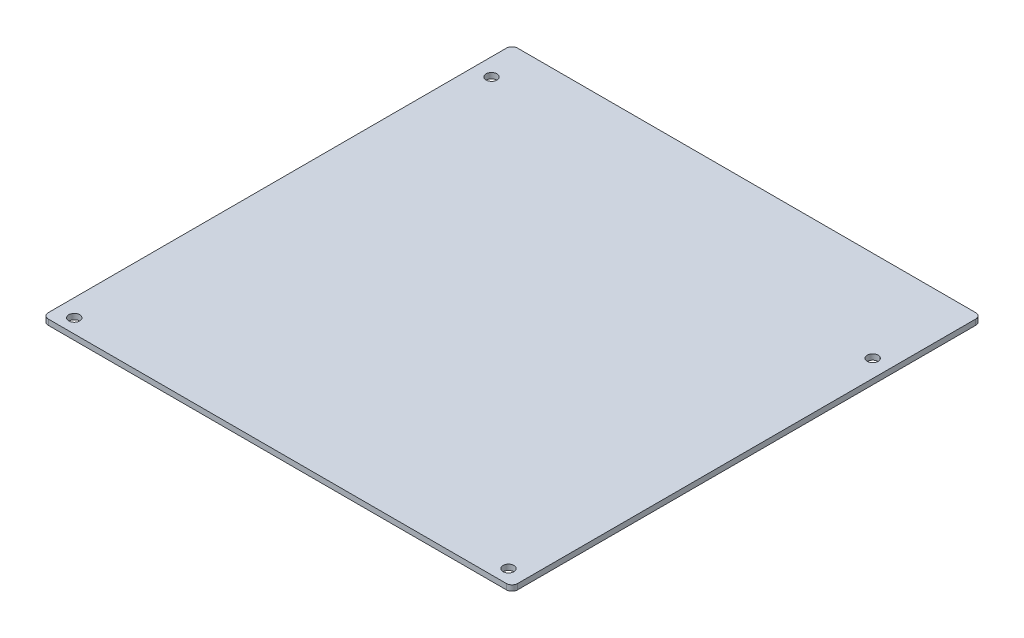
from build123d import *

# Parameters (mm, degrees)
SKETCH1_W           = 170.18
SKETCH1_H           = 170.18
BOSS_EXTRUDE1_DEPTH = 2
FILLET1_R           = 2
SKETCH3_R           = 1.975
CUT_EXTRUDE1_DEPTH  = 121.352051083


with BuildPart() as part:
    # Sketch1 → Boss-Extrude1 (new body)
    with BuildSketch(Plane(origin=(0, 0, 0), x_dir=(1, 0, 0), z_dir=(0, 1, 0))):
        Rectangle(SKETCH1_W, SKETCH1_H)
    extrude(amount=BOSS_EXTRUDE1_DEPTH)

    # Fillet1
    fillet1_edges = [part.edges().sort_by_distance(p)[0] for p in [
        (85.09, 1, 85.09),
        (-85.09, 1, 85.09),
        (-85.09, 1, -85.09),
        (85.09, 1, -85.09),
    ]]
    fillet(fillet1_edges, radius=FILLET1_R)

    # Sketch3 → Cut-Extrude1 (cut, through all)
    with BuildSketch(Plane(origin=(0, 2, 0), x_dir=(1, 0, 0), z_dir=(0, 1, 0))):
        with Locations(Location((-78.74, 71.321596211, 0), (0, 0, 270))):
            Circle(SKETCH3_R)
        with Locations(Location((78.74, 52.07, 0), (0, 0, 270))):
            Circle(SKETCH3_R)
        with Locations(Location((78.74, -80.01, 0), (0, 0, 270))):
            Circle(SKETCH3_R)
        with Locations(Location((-78.74, -80.01, 0), (0, 0, 270))):
            Circle(SKETCH3_R)
    extrude(amount=-CUT_EXTRUDE1_DEPTH, mode=Mode.SUBTRACT)


solid = part.part
